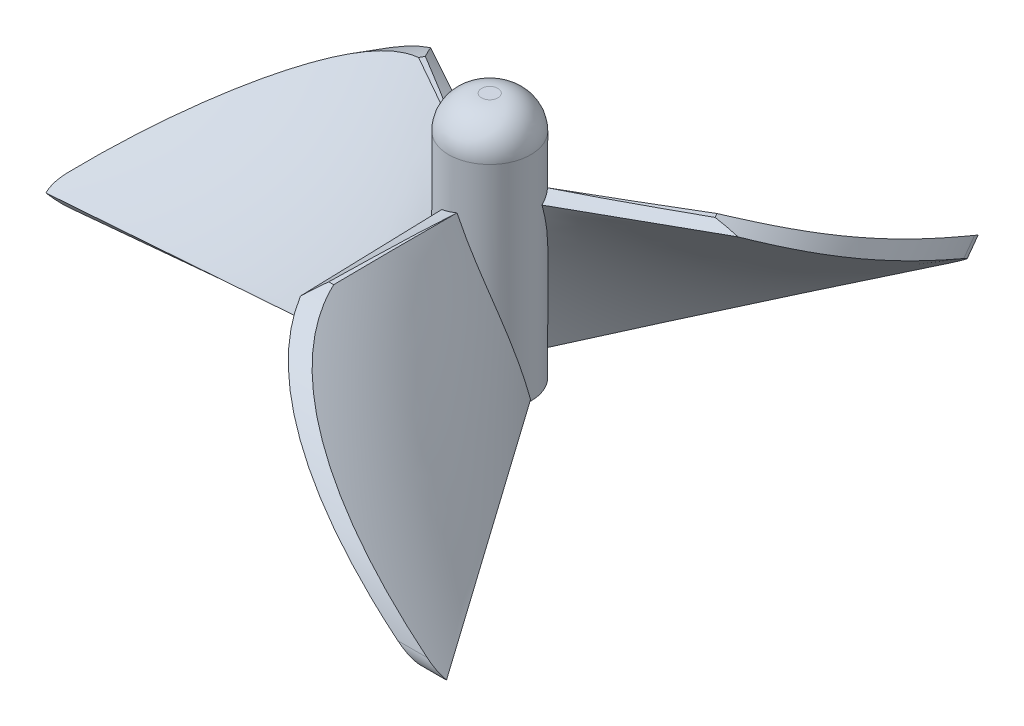
from build123d import *

# Parameters (mm, degrees)
SKETCH1_R           = 2.5
BOSS_EXTRUDE1_DEPTH = 15
CUT_EXTRUDE1_START  = -4
CUT_EXTRUDE1_DEPTH  = 24
CIRPATTERN1_COUNT   = 3
SKETCH5_R           = 1
CUT_EXTRUDE2_DEPTH  = 8
FILLET1_R           = 2


with BuildPart() as part:
    # Sketch1 → Boss-Extrude1 (new body)
    with BuildSketch(Plane(origin=(0, 0, 0), x_dir=(1, 0, 0), z_dir=(0, 1, 0))):
        Circle(SKETCH1_R)
    extrude(amount=BOSS_EXTRUDE1_DEPTH)

    # Sketch2 → Loft1 section 0
    with BuildSketch(Plane.XY):
        with BuildLine():
            Line((-0.490290338, 9.901941932), (0.490290338, 10.098058068))
            Line((0.490290338, 10.098058068), (2.490290338, 0.098058068))
            Line((2.490290338, 0.098058068), (1.509709662, -0.098058068))
            Line((1.509709662, -0.098058068), (-0.490290338, 9.901941932))
        make_face()
    # Sketch3 → Loft1 section 1
    with BuildSketch(Plane.XY.offset(18)):
        with BuildLine():
            Line((0.277350098, 10.416025147), (-0.277350098, 9.583974853))
            Line((-0.277350098, 9.583974853), (14.722649902, -0.416025147))
            Line((14.722649902, -0.416025147), (15.277350098, 0.416025147))
            Line((15.277350098, 0.416025147), (0.277350098, 10.416025147))
        make_face()
    loft1 = loft()

    # Sketch4 → Cut-Extrude1 (cut)
    with BuildSketch(Plane(origin=(0, 0, 0), x_dir=(0, 0, -1), z_dir=(1, 0, 0)).offset(CUT_EXTRUDE1_START)):
        with BuildLine():
            Line((-2.5, 0), (-16.873666391, 0))
            ThreePointArc((-16.873666391, 0), (-17.638701098, 0.35601095), (-17.85901434, 1.170556207))
            ThreePointArc((-17.85901434, 1.170556207), (-15.190311544, 6.760544166), (-10, 10.141462099))
            Line((-10, 10.141462099), (-2.5, 10.141462099))
            Line((-2.5, 10.141462099), (-2.5, 10.760596561))
            Line((-2.5, 10.760596561), (-20.212640045, 10.760596561))
            Line((-20.212640045, 10.760596561), (-20.212640045, -1.946882985))
            Line((-20.212640045, -1.946882985), (-2.5, -1.111727068))
            Line((-2.5, -1.111727068), (0, -1.111727068))
            Line((0, -1.111727068), (0, 0))
            Line((0, 0), (-2.5, 0))
        make_face()
    cut_extrude1 = extrude(amount=CUT_EXTRUDE1_DEPTH, mode=Mode.SUBTRACT)

    # CirPattern1: Loft1, Cut-Extrude1 ×3 about axis
    cirpattern1_axis = Axis((0, 15, 0), (0, -1, 0))
    add([loft1.rotate(cirpattern1_axis, i * 360 / CIRPATTERN1_COUNT) for i in range(1, CIRPATTERN1_COUNT)])
    add([cut_extrude1.rotate(cirpattern1_axis, i * 360 / CIRPATTERN1_COUNT) for i in range(1, CIRPATTERN1_COUNT)], mode=Mode.SUBTRACT)

    # Sketch5 → Cut-Extrude2 (cut)
    with BuildSketch(Plane.XZ):
        Circle(SKETCH5_R)
    extrude(amount=-CUT_EXTRUDE2_DEPTH, mode=Mode.SUBTRACT)

    # Fillet1
    fillet1_edges = [part.edges().sort_by_distance(p)[0] for p in [
        (-2.5, 15, 0),
    ]]
    fillet(fillet1_edges, radius=FILLET1_R)


solid = part.part
